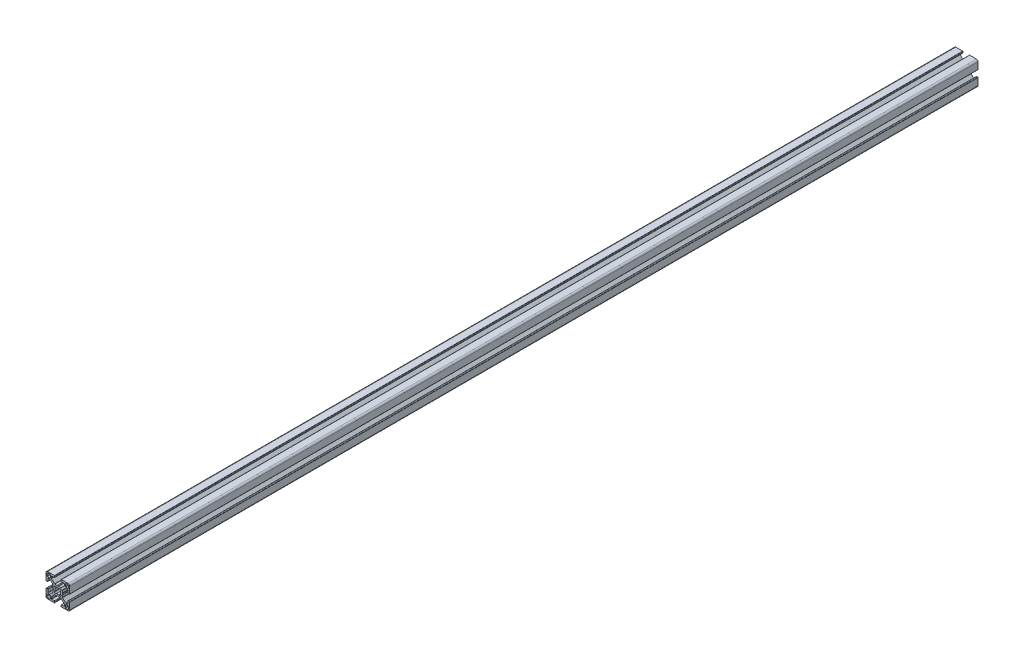
from build123d import *

# Parameters (mm, degrees)
EXTRUDE1_DEPTH     = 1150
SKETCH3_R          = 3.175
CUT_EXTRUDE2_DEPTH = 1151.489022547


with BuildPart() as part:
    # Sketch1 → Extrude1 (new body)
    with BuildSketch(Plane.XY):
        with BuildLine():
            Line((12.74247465, -4.5), (12.74247465, -7.732519321))
            ThreePointArc((12.74247465, -7.732519321), (12.602449697, -8.097296796), (12.242781236, -8.249967))
            Line((12.242781236, -8.249967), (10.260188032, -8.249967))
            ThreePointArc((10.260188032, -8.249967), (10.068847082, -8.211906919), (9.906636056, -8.103520976))
            Line((9.906636056, -8.103520976), (5.981117769, -4.178002689))
            ThreePointArc((5.981117769, -4.178002689), (5.872731827, -4.015791664), (5.834671745, -3.824450713))
            Line((5.834671745, -3.824450713), (5.834671745, -1.01249595))
            Line((5.834671745, -1.01249595), (5.324673785, -0.06249975))
            Line((5.324673785, -0.06249975), (5.834671745, 0.88749645))
            Line((5.834671745, 0.88749645), (5.834671745, 3.824450713))
            ThreePointArc((5.834671745, 3.824450713), (5.872731827, 4.015791664), (5.981117769, 4.178002689))
            Line((5.981117769, 4.178002689), (9.906636056, 8.103520976))
            ThreePointArc((9.906636056, 8.103520976), (10.068847082, 8.211906919), (10.260188032, 8.249967))
            Line((10.260188032, 8.249967), (12.242781236, 8.249967))
            ThreePointArc((12.242781236, 8.249967), (12.602449697, 8.097296796), (12.74247465, 7.732519321))
            Line((12.74247465, 7.732519321), (12.74247465, 4.5))
            ThreePointArc((12.74247465, 4.5), (12.88892126, 4.146446609), (13.24247465, 4))
            Line((13.24247465, 4), (14.49994, 4))
            ThreePointArc((14.49994, 4), (14.853493391, 4.146446609), (14.99994, 4.5))
            Line((14.99994, 4.5), (14.99994, 12.999948))
            ThreePointArc((14.99994, 12.999948), (14.414155906, 14.414155906), (12.999948, 14.99994))
            Line((12.999948, 14.99994), (4.5, 14.99994))
            ThreePointArc((4.5, 14.99994), (4.146446609, 14.853493391), (4, 14.49994))
            Line((4, 14.49994), (4, 13.24247465))
            ThreePointArc((4, 13.24247465), (4.146446609, 12.88892126), (4.5, 12.74247465))
            Line((4.5, 12.74247465), (7.732519321, 12.74247465))
            ThreePointArc((7.732519321, 12.74247465), (8.097296796, 12.602449697), (8.249967, 12.242781236))
            Line((8.249967, 12.242781236), (8.249967, 10.260188032))
            ThreePointArc((8.249967, 10.260188032), (8.211906919, 10.068847082), (8.103520976, 9.906636056))
            Line((8.103520976, 9.906636056), (4.178002689, 5.981117769))
            ThreePointArc((4.178002689, 5.981117769), (4.015791664, 5.872731827), (3.824450713, 5.834671745))
            Line((3.824450713, 5.834671745), (0.9499962, 5.834671745))
            Line((0.9499962, 5.834671745), (0, 5.324673785))
            Line((0, 5.324673785), (-0.9499962, 5.834671745))
            Line((-0.9499962, 5.834671745), (-3.824450713, 5.834671745))
            ThreePointArc((-3.824450713, 5.834671745), (-4.015791664, 5.872731827), (-4.178002689, 5.981117769))
            Line((-4.178002689, 5.981117769), (-8.103520976, 9.906636056))
            ThreePointArc((-8.103520976, 9.906636056), (-8.211906919, 10.068847082), (-8.249967, 10.260188032))
            Line((-8.249967, 10.260188032), (-8.249967, 12.242781236))
            ThreePointArc((-8.249967, 12.242781236), (-8.097296796, 12.602449697), (-7.732519321, 12.74247465))
            Line((-7.732519321, 12.74247465), (-4.5, 12.74247465))
            ThreePointArc((-4.5, 12.74247465), (-4.146446609, 12.88892126), (-4, 13.24247465))
            Line((-4, 13.24247465), (-4, 14.49994))
            ThreePointArc((-4, 14.49994), (-4.146446609, 14.853493391), (-4.5, 14.99994))
            Line((-4.5, 14.99994), (-12.999948, 14.99994))
            ThreePointArc((-12.999948, 14.99994), (-14.414155906, 14.414155906), (-14.99994, 12.999948))
            Line((-14.99994, 12.999948), (-14.99994, 4.5))
            ThreePointArc((-14.99994, 4.5), (-14.853493391, 4.146446609), (-14.49994, 4))
            Line((-14.49994, 4), (-13.24247465, 4))
            ThreePointArc((-13.24247465, 4), (-12.88892126, 4.146446609), (-12.74247465, 4.5))
            Line((-12.74247465, 4.5), (-12.74247465, 7.732519321))
            ThreePointArc((-12.74247465, 7.732519321), (-12.602449697, 8.097296796), (-12.242781236, 8.249967))
            Line((-12.242781236, 8.249967), (-10.260188032, 8.249967))
            ThreePointArc((-10.260188032, 8.249967), (-10.068847082, 8.211906919), (-9.906636056, 8.103520976))
            Line((-9.906636056, 8.103520976), (-5.981117769, 4.178002689))
            ThreePointArc((-5.981117769, 4.178002689), (-5.872731827, 4.015791664), (-5.834671745, 3.824450713))
            Line((-5.834671745, 3.824450713), (-5.834671745, 0.88749645))
            Line((-5.834671745, 0.88749645), (-5.324673785, -0.06249975))
            Line((-5.324673785, -0.06249975), (-5.834671745, -1.01249595))
            Line((-5.834671745, -1.01249595), (-5.834671745, -3.824450713))
            ThreePointArc((-5.834671745, -3.824450713), (-5.872731827, -4.015791664), (-5.981117769, -4.178002689))
            Line((-5.981117769, -4.178002689), (-9.906636056, -8.103520976))
            ThreePointArc((-9.906636056, -8.103520976), (-10.068847082, -8.211906919), (-10.260188032, -8.249967))
            Line((-10.260188032, -8.249967), (-12.242781236, -8.249967))
            ThreePointArc((-12.242781236, -8.249967), (-12.602449697, -8.097296796), (-12.74247465, -7.732519321))
            Line((-12.74247465, -7.732519321), (-12.74247465, -4.5))
            ThreePointArc((-12.74247465, -4.5), (-12.88892126, -4.146446609), (-13.24247465, -4))
            Line((-13.24247465, -4), (-14.49994, -4))
            ThreePointArc((-14.49994, -4), (-14.853493391, -4.146446609), (-14.99994, -4.5))
            Line((-14.99994, -4.5), (-14.99994, -12.999948))
            ThreePointArc((-14.99994, -12.999948), (-14.414155906, -14.414155906), (-12.999948, -14.99994))
            Line((-12.999948, -14.99994), (-4.5, -14.99994))
            ThreePointArc((-4.5, -14.99994), (-4.146446609, -14.853493391), (-4, -14.49994))
            Line((-4, -14.49994), (-4, -13.24247465))
            ThreePointArc((-4, -13.24247465), (-4.146446609, -12.88892126), (-4.5, -12.74247465))
            Line((-4.5, -12.74247465), (-7.732519321, -12.74247465))
            ThreePointArc((-7.732519321, -12.74247465), (-8.097296796, -12.602449697), (-8.249967, -12.242781236))
            Line((-8.249967, -12.242781236), (-8.249967, -10.260188032))
            ThreePointArc((-8.249967, -10.260188032), (-8.211906919, -10.068847082), (-8.103520976, -9.906636056))
            Line((-8.103520976, -9.906636056), (-4.178002689, -5.981117769))
            ThreePointArc((-4.178002689, -5.981117769), (-4.015791664, -5.872731827), (-3.824450713, -5.834671745))
            Line((-3.824450713, -5.834671745), (-0.9499962, -5.834671745))
            Line((-0.9499962, -5.834671745), (0, -5.324673785))
            Line((0, -5.324673785), (0.9499962, -5.834671745))
            Line((0.9499962, -5.834671745), (3.824450713, -5.834671745))
            ThreePointArc((3.824450713, -5.834671745), (4.015791664, -5.872731827), (4.178002689, -5.981117769))
            Line((4.178002689, -5.981117769), (8.103520976, -9.906636056))
            ThreePointArc((8.103520976, -9.906636056), (8.211906919, -10.068847082), (8.249967, -10.260188032))
            Line((8.249967, -10.260188032), (8.249967, -12.242781236))
            ThreePointArc((8.249967, -12.242781236), (8.097296796, -12.602449697), (7.732519321, -12.74247465))
            Line((7.732519321, -12.74247465), (4.5, -12.74247465))
            ThreePointArc((4.5, -12.74247465), (4.146446609, -12.88892126), (4, -13.24247465))
            Line((4, -13.24247465), (4, -14.49994))
            ThreePointArc((4, -14.49994), (4.146446609, -14.853493391), (4.5, -14.99994))
            Line((4.5, -14.99994), (12.999948, -14.99994))
            ThreePointArc((12.999948, -14.99994), (14.414155906, -14.414155906), (14.99994, -12.999948))
            Line((14.99994, -12.999948), (14.99994, -4.5))
            ThreePointArc((14.99994, -4.5), (14.853493391, -4.146446609), (14.49994, -4))
            Line((14.49994, -4), (13.24247465, -4))
            ThreePointArc((13.24247465, -4), (12.88892126, -4.146446609), (12.74247465, -4.5))
        make_face()
        with BuildLine():
            Line((9.499962, -13.318946724), (9.499962, -9.87996048))
            ThreePointArc((9.499962, -9.87996048), (9.611260978, -9.611260978), (9.87996048, -9.499962))
            Line((9.87996048, -9.499962), (13.318946724, -9.499962))
            ThreePointArc((13.318946724, -9.499962), (13.58835333, -9.61155387), (13.6999452, -9.880960476))
            Line((13.6999452, -9.880960476), (13.6999452, -12.6999492))
            ThreePointArc((13.6999452, -12.6999492), (13.407053153, -13.407053153), (12.6999492, -13.6999452))
            Line((12.6999492, -13.6999452), (9.880960476, -13.6999452))
            ThreePointArc((9.880960476, -13.6999452), (9.61155387, -13.58835333), (9.499962, -13.318946724))
        make_face(mode=Mode.SUBTRACT)
        with BuildLine():
            Line((-13.318946724, -9.499962), (-9.87996048, -9.499962))
            ThreePointArc((-9.87996048, -9.499962), (-9.611260978, -9.611260978), (-9.499962, -9.87996048))
            Line((-9.499962, -9.87996048), (-9.499962, -13.318946724))
            ThreePointArc((-9.499962, -13.318946724), (-9.61155387, -13.58835333), (-9.880960476, -13.6999452))
            Line((-9.880960476, -13.6999452), (-12.6999492, -13.6999452))
            ThreePointArc((-12.6999492, -13.6999452), (-13.407053153, -13.407053153), (-13.6999452, -12.6999492))
            Line((-13.6999452, -12.6999492), (-13.6999452, -9.880960476))
            ThreePointArc((-13.6999452, -9.880960476), (-13.58835333, -9.61155387), (-13.318946724, -9.499962))
        make_face(mode=Mode.SUBTRACT)
        with BuildLine():
            Line((-1.494225248, -3.198138712), (-2.473341823, -3.979927146))
            ThreePointArc((-2.473341823, -3.979927146), (-3.900227701, -3.900227701), (-3.979927146, -2.473341823))
            Line((-3.979927146, -2.473341823), (-3.198138712, -1.494225248))
            ThreePointArc((-3.198138712, -1.494225248), (-3.52998588, 0), (-3.198138712, 1.494225248))
            Line((-3.198138712, 1.494225248), (-3.979927146, 2.473341823))
            ThreePointArc((-3.979927146, 2.473341823), (-3.900227701, 3.900227701), (-2.473341823, 3.979927146))
            Line((-2.473341823, 3.979927146), (-1.494225248, 3.198138712))
            ThreePointArc((-1.494225248, 3.198138712), (0, 3.52998588), (1.494225248, 3.198138712))
            Line((1.494225248, 3.198138712), (2.473341823, 3.979927146))
            ThreePointArc((2.473341823, 3.979927146), (3.900227701, 3.900227701), (3.979927146, 2.473341823))
            Line((3.979927146, 2.473341823), (3.198138712, 1.494225248))
            ThreePointArc((3.198138712, 1.494225248), (3.52998588, 0), (3.198138712, -1.494225248))
            Line((3.198138712, -1.494225248), (3.979927146, -2.473341823))
            ThreePointArc((3.979927146, -2.473341823), (3.900227701, -3.900227701), (2.473341823, -3.979927146))
            Line((2.473341823, -3.979927146), (1.494225248, -3.198138712))
            ThreePointArc((1.494225248, -3.198138712), (0, -3.52998588), (-1.494225248, -3.198138712))
        make_face(mode=Mode.SUBTRACT)
        with BuildLine():
            Line((-9.499962, 13.318946724), (-9.499962, 9.87996048))
            ThreePointArc((-9.499962, 9.87996048), (-9.611260978, 9.611260978), (-9.87996048, 9.499962))
            Line((-9.87996048, 9.499962), (-13.318946724, 9.499962))
            ThreePointArc((-13.318946724, 9.499962), (-13.58835333, 9.61155387), (-13.6999452, 9.880960476))
            Line((-13.6999452, 9.880960476), (-13.6999452, 12.6999492))
            ThreePointArc((-13.6999452, 12.6999492), (-13.407053153, 13.407053153), (-12.6999492, 13.6999452))
            Line((-12.6999492, 13.6999452), (-9.880960476, 13.6999452))
            ThreePointArc((-9.880960476, 13.6999452), (-9.61155387, 13.58835333), (-9.499962, 13.318946724))
        make_face(mode=Mode.SUBTRACT)
        with BuildLine():
            Line((9.880960476, 13.6999452), (12.6999492, 13.6999452))
            ThreePointArc((12.6999492, 13.6999452), (13.407053153, 13.407053153), (13.6999452, 12.6999492))
            Line((13.6999452, 12.6999492), (13.6999452, 9.880960476))
            ThreePointArc((13.6999452, 9.880960476), (13.58835333, 9.61155387), (13.318946724, 9.499962))
            Line((13.318946724, 9.499962), (9.87996048, 9.499962))
            ThreePointArc((9.87996048, 9.499962), (9.611260978, 9.611260978), (9.499962, 9.87996048))
            Line((9.499962, 9.87996048), (9.499962, 13.318946724))
            ThreePointArc((9.499962, 13.318946724), (9.61155387, 13.58835333), (9.880960476, 13.6999452))
        make_face(mode=Mode.SUBTRACT)
    extrude(amount=-EXTRUDE1_DEPTH)

    # Sketch3 → Cut-Extrude2 (cut, through all)
    with BuildSketch(Plane(origin=(0, 14.99994, 0), x_dir=(1, 0, 0), z_dir=(0, 1, 0))):
        with Locations(Location((0, 575, 0), (0, 0, 270))):
            Circle(SKETCH3_R)
    extrude(amount=-CUT_EXTRUDE2_DEPTH, mode=Mode.SUBTRACT)


solid = part.part
